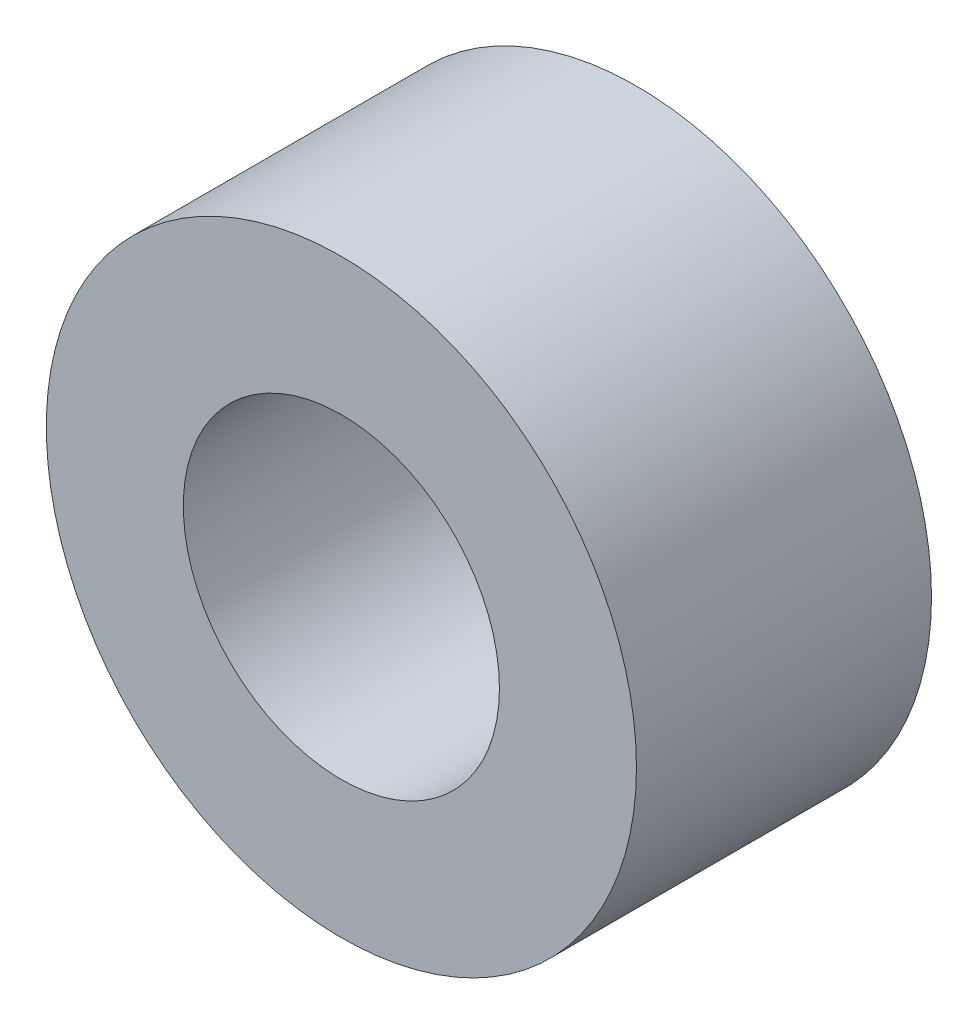
from build123d import *

# Parameters (mm, degrees)
SKETCH1_R           = 8.89
SKETCH1_R_2         = 4.7625
BOSS_EXTRUDE1_DEPTH = 4.445


with BuildPart() as part:
    # Sketch1 → Boss-Extrude1 (new, symmetric)
    with BuildSketch(Plane.XY):
        Circle(SKETCH1_R)
        Circle(SKETCH1_R_2, mode=Mode.SUBTRACT)
    extrude(amount=BOSS_EXTRUDE1_DEPTH, both=True)


solid = part.part
